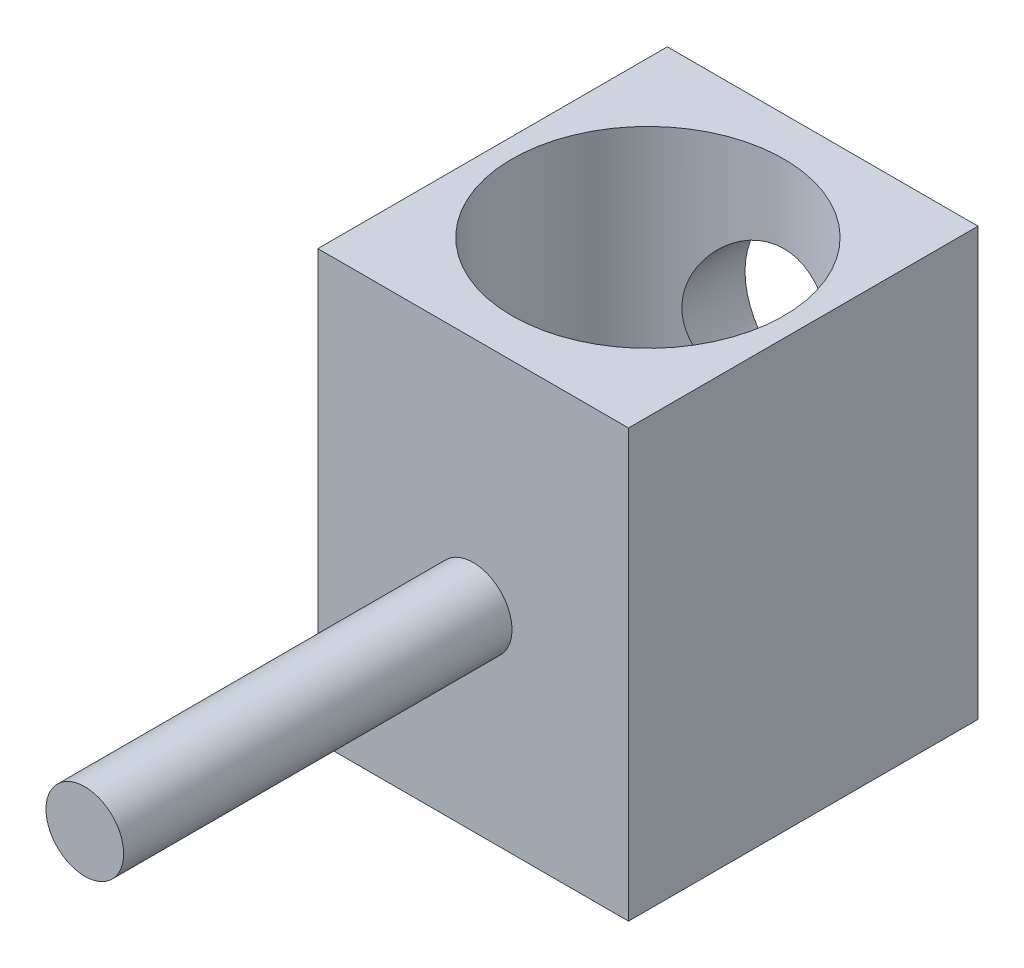
from build123d import *

# Parameters (mm, degrees)
SKETCH4_W           = 4
SKETCH4_H           = 4.5
BOSS_EXTRUDE1_DEPTH = 5.5
SKETCH5_R           = 0.5
BOSS_EXTRUDE2_DEPTH = 5
SKETCH6_R           = 1.75
CUT_EXTRUDE1_DEPTH  = 5
SKETCH7_R           = 1
CUT_EXTRUDE2_DEPTH  = 2


with BuildPart() as part:
    # Sketch4 → Boss-Extrude1 (new body)
    with BuildSketch(Plane(origin=(0, 0, 0), x_dir=(1, 0, 0), z_dir=(0, 1, 0))):
        Rectangle(SKETCH4_W, SKETCH4_H)
    extrude(amount=BOSS_EXTRUDE1_DEPTH)

    # Sketch5 → Boss-Extrude2 (add)
    with BuildSketch(Plane.XY.offset(2.25)):
        with Locations(Location((0, 2.5, 0), (0, 0, 180))):
            Circle(SKETCH5_R)
    extrude(amount=BOSS_EXTRUDE2_DEPTH)

    # Sketch6 → Cut-Extrude1 (cut)
    with BuildSketch(Plane(origin=(0, 5.5, 0), x_dir=(1, 0, 0), z_dir=(0, 1, 0))):
        with Locations(Location((0, 0, 0), (0, 0, 270))):
            Circle(SKETCH6_R)
    extrude(amount=-CUT_EXTRUDE1_DEPTH, mode=Mode.SUBTRACT)

    # Sketch7 → Cut-Extrude2 (cut)
    with BuildSketch(Plane(origin=(0, 0, -2.25), x_dir=(-1, 0, 0), z_dir=(0, 0, -1))):
        with Locations((0, 3.5)):
            Circle(SKETCH7_R)
    extrude(amount=-CUT_EXTRUDE2_DEPTH, mode=Mode.SUBTRACT)


solid = part.part
